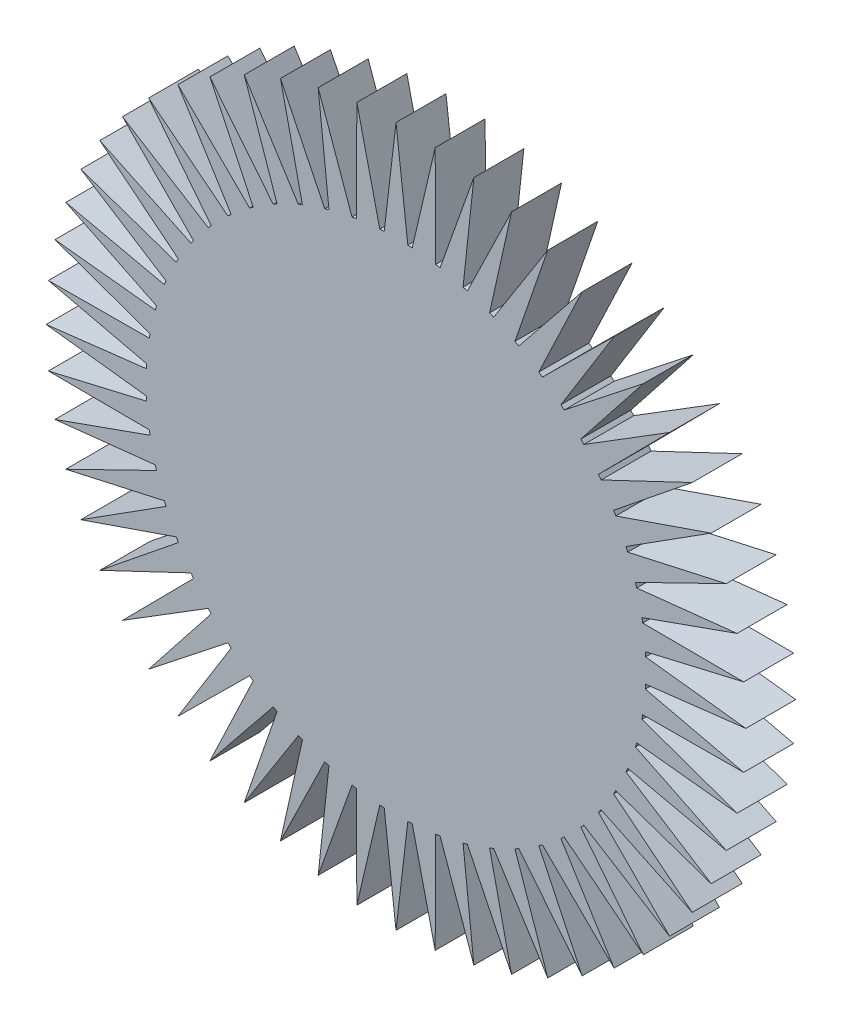
from build123d import *

# Parameters (mm, degrees)
ESQUISSE1_R             = 35
BOSS_EXTRU_1_DEPTH      = 5
ENL_V_START             = -5
ENL_V_MAT_EXTRU_2_DEPTH = 5


with BuildPart() as part:
    # Esquisse1 → Boss.-Extru.1 (new body)
    with BuildSketch(Plane.XY):
        Circle(ESQUISSE1_R)
    extrude(amount=BOSS_EXTRU_1_DEPTH)

    # Esquisse3 → Enlèv. mat.-Extru.2 (cut)
    with BuildSketch(Plane.XY.offset(5).offset(ENL_V_START)):
        with BuildLine():
            Line((-11.898891299, 21.986732041), (-15.185930869, 31.533910377))
            ThreePointArc((-15.185930869, 31.533910377), (-16.930161049, 30.632819767), (-18.621122678, 29.635346973))
            Line((-18.621122678, 29.635346973), (-12.286106235, 21.77272591))
            ThreePointArc((-12.286106235, 21.77272591), (-12.092972178, 21.880585548), (-11.898891299, 21.986732041))
        make_face()
        with BuildLine():
            Line((-9.362340634, 23.180737216), (-11.559767168, 33.035916561))
            ThreePointArc((-11.559767168, 33.035916561), (-13.393920133, 32.335783638), (-15.185930869, 31.533910377))
            Line((-15.185930869, 31.533910377), (-9.771081928, 23.011431028))
            ThreePointArc((-9.771081928, 23.011431028), (-9.567085809, 23.096988313), (-9.362340634, 23.180737216))
        make_face()
        with BuildLine():
            Line((-6.708053103, 24.08323117), (-7.788232688, 34.122476926))
            ThreePointArc((-7.788232688, 34.122476926), (-9.6892429, 33.632106268), (-11.559767168, 33.035916561))
            Line((-11.559767168, 33.035916561), (-7.133180597, 23.960754049))
            ThreePointArc((-7.133180597, 23.960754049), (-6.920887786, 24.022933049), (-6.708053103, 24.08323117))
        make_face()
        with BuildLine():
            Line((-3.969407912, 24.682864518), (-3.918756664, 34.779927346))
            ThreePointArc((-3.918756664, 34.779927346), (-5.862717816, 34.505485648), (-7.788232688, 34.122476926))
            Line((-7.788232688, 34.122476926), (-4.40557538, 24.608756685))
            ThreePointArc((-4.40557538, 24.608756685), (-4.187655583, 24.646775463), (-3.969407912, 24.682864518))
        make_face()
        with BuildLine():
            Line((-1.180845114, 24.972096524), (0, 35))
            ThreePointArc((0, 35), (-1.962465653, 34.944938526), (-3.918756664, 34.779927346))
            Line((-3.918756664, 34.779927346), (-1.622567497, 24.947289927))
            ThreePointArc((-1.622567497, 24.947289927), (-1.401761181, 24.960670375), (-1.180845114, 24.972096524))
        make_face()
        with BuildLine():
            ThreePointArc((3.918756664, 34.779927346), (1.962465653, 34.944938526), (0, 35))
            Line((0, 35), (1.180845114, 24.972096524))
            ThreePointArc((1.180845114, 24.972096524), (1.401761181, 24.960670375), (1.622567497, 24.947289927))
            Line((1.622567497, 24.947289927), (3.918756664, 34.779927346))
        make_face()
        with BuildLine():
            ThreePointArc((7.788232688, 34.122476926), (5.862717816, 34.505485648), (3.918756664, 34.779927346))
            Line((3.918756664, 34.779927346), (3.969407912, 24.682864518))
            ThreePointArc((3.969407912, 24.682864518), (4.187655583, 24.646775463), (4.40557538, 24.608756685))
            Line((4.40557538, 24.608756685), (7.788232688, 34.122476926))
        make_face()
        with BuildLine():
            ThreePointArc((11.559767168, 33.035916561), (9.6892429, 33.632106268), (7.788232688, 34.122476926))
            Line((7.788232688, 34.122476926), (6.708053103, 24.08323117))
            ThreePointArc((6.708053103, 24.08323117), (6.920887786, 24.022933049), (7.133180597, 23.960754049))
            Line((7.133180597, 23.960754049), (11.559767168, 33.035916561))
        make_face()
        with BuildLine():
            ThreePointArc((15.185930869, 31.533910377), (13.393920133, 32.335783638), (11.559767168, 33.035916561))
            Line((11.559767168, 33.035916561), (9.362340634, 23.180737216))
            ThreePointArc((9.362340634, 23.180737216), (9.567085809, 23.096988313), (9.771081928, 23.011431028))
            Line((9.771081928, 23.011431028), (15.185930869, 31.533910377))
        make_face()
        with BuildLine():
            ThreePointArc((18.621122678, 29.635346973), (16.930161049, 30.632819767), (15.185930869, 31.533910377))
            Line((15.185930869, 31.533910377), (11.898891299, 21.986732041))
            ThreePointArc((11.898891299, 21.986732041), (12.092972178, 21.880585548), (12.286106235, 21.77272591))
            Line((12.286106235, 21.77272591), (18.621122678, 29.635346973))
        make_face()
        with BuildLine():
            ThreePointArc((21.822143065, 27.364101886), (20.253495366, 28.544630414), (18.621122678, 29.635346973))
            Line((18.621122678, 29.635346973), (14.285806502, 20.516230955))
            ThreePointArc((14.285806502, 20.516230955), (14.466782404, 20.389021724), (14.646625628, 20.260216132))
            Line((14.646625628, 20.260216132), (21.822143065, 27.364101886))
        make_face()
        with BuildLine():
            ThreePointArc((24.748737342, 24.748737342), (23.322130228, 26.097475771), (21.822143065, 27.364101886))
            Line((21.822143065, 27.364101886), (16.4930694, 18.78772636))
            ThreePointArc((16.4930694, 18.78772636), (16.658664449, 18.641054122), (16.822955205, 18.49292238))
            Line((16.822955205, 18.49292238), (24.748737342, 24.748737342))
        make_face()
        with BuildLine():
            Line((-14.285806502, 20.516230955), (-18.621122678, 29.635346973))
            ThreePointArc((-18.621122678, 29.635346973), (-20.253495366, 28.544630414), (-21.822143065, 27.364101886))
            Line((-21.822143065, 27.364101886), (-14.646625628, 20.260216132))
            ThreePointArc((-14.646625628, 20.260216132), (-14.466782404, 20.389021724), (-14.285806502, 20.516230955))
        make_face()
        with BuildLine():
            Line((-16.4930694, 18.78772636), (-21.822143065, 27.364101886))
            ThreePointArc((-21.822143065, 27.364101886), (-23.322130228, 26.097475771), (-24.748737342, 24.748737342))
            Line((-24.748737342, 24.748737342), (-16.822955205, 18.49292238))
            ThreePointArc((-16.822955205, 18.49292238), (-16.658664449, 18.641054122), (-16.4930694, 18.78772636))
        make_face()
        with BuildLine():
            Line((-18.49292238, 16.822955205), (-24.748737342, 24.748737342))
            ThreePointArc((-24.748737342, 24.748737342), (-26.097475771, 23.322130228), (-27.364101886, 21.822143065))
            Line((-27.364101886, 21.822143065), (-18.78772636, 16.4930694))
            ThreePointArc((-18.78772636, 16.4930694), (-18.641054122, 16.658664449), (-18.49292238, 16.822955205))
        make_face()
        with BuildLine():
            Line((-20.260216132, 14.646625628), (-27.364101886, 21.822143065))
            ThreePointArc((-27.364101886, 21.822143065), (-28.544630414, 20.253495366), (-29.635346973, 18.621122678))
            Line((-29.635346973, 18.621122678), (-20.516230955, 14.285806502))
            ThreePointArc((-20.516230955, 14.285806502), (-20.389021724, 14.466782404), (-20.260216132, 14.646625628))
        make_face()
        with BuildLine():
            Line((-21.77272591, 12.286106235), (-29.635346973, 18.621122678))
            ThreePointArc((-29.635346973, 18.621122678), (-30.632819767, 16.930161049), (-31.533910377, 15.185930869))
            Line((-31.533910377, 15.185930869), (-21.986732041, 11.898891299))
            ThreePointArc((-21.986732041, 11.898891299), (-21.880585548, 12.092972178), (-21.77272591, 12.286106235))
        make_face()
        with BuildLine():
            Line((-23.011431028, 9.771081928), (-31.533910377, 15.185930869))
            ThreePointArc((-31.533910377, 15.185930869), (-32.335783638, 13.393920133), (-33.035916561, 11.559767168))
            Line((-33.035916561, 11.559767168), (-23.180737216, 9.362340634))
            ThreePointArc((-23.180737216, 9.362340634), (-23.096988313, 9.567085809), (-23.011431028, 9.771081928))
        make_face()
        with BuildLine():
            Line((-23.960754049, 7.133180597), (-33.035916561, 11.559767168))
            ThreePointArc((-33.035916561, 11.559767168), (-33.632106268, 9.6892429), (-34.122476926, 7.788232688))
            Line((-34.122476926, 7.788232688), (-24.08323117, 6.708053103))
            ThreePointArc((-24.08323117, 6.708053103), (-24.022933049, 6.920887786), (-23.960754049, 7.133180597))
        make_face()
        with BuildLine():
            Line((-24.608756685, 4.40557538), (-34.122476926, 7.788232688))
            ThreePointArc((-34.122476926, 7.788232688), (-34.505485648, 5.862717816), (-34.779927346, 3.918756664))
            Line((-34.779927346, 3.918756664), (-24.682864518, 3.969407912))
            ThreePointArc((-24.682864518, 3.969407912), (-24.646775463, 4.187655583), (-24.608756685, 4.40557538))
        make_face()
        with BuildLine():
            Line((-24.947289927, 1.622567497), (-34.779927346, 3.918756664))
            ThreePointArc((-34.779927346, 3.918756664), (-34.944938526, 1.962465653), (-35, 0))
            Line((-35, 0), (-24.972096524, 1.180845114))
            ThreePointArc((-24.972096524, 1.180845114), (-24.960670375, 1.401761181), (-24.947289927, 1.622567497))
        make_face()
        with BuildLine():
            Line((-24.972096524, -1.180845114), (-35, 0))
            ThreePointArc((-35, 0), (-34.944938526, -1.962465653), (-34.779927346, -3.918756664))
            Line((-34.779927346, -3.918756664), (-24.947289927, -1.622567497))
            ThreePointArc((-24.947289927, -1.622567497), (-24.960670375, -1.401761181), (-24.972096524, -1.180845114))
        make_face()
        with BuildLine():
            Line((-24.682864518, -3.969407912), (-34.779927346, -3.918756664))
            ThreePointArc((-34.779927346, -3.918756664), (-34.505485648, -5.862717816), (-34.122476926, -7.788232688))
            Line((-34.122476926, -7.788232688), (-24.608756685, -4.40557538))
            ThreePointArc((-24.608756685, -4.40557538), (-24.646775463, -4.187655583), (-24.682864518, -3.969407912))
        make_face()
        with BuildLine():
            Line((-24.08323117, -6.708053103), (-34.122476926, -7.788232688))
            ThreePointArc((-34.122476926, -7.788232688), (-33.632106268, -9.6892429), (-33.035916561, -11.559767168))
            Line((-33.035916561, -11.559767168), (-23.960754049, -7.133180597))
            ThreePointArc((-23.960754049, -7.133180597), (-24.022933049, -6.920887786), (-24.08323117, -6.708053103))
        make_face()
        with BuildLine():
            Line((-23.180737216, -9.362340634), (-33.035916561, -11.559767168))
            ThreePointArc((-33.035916561, -11.559767168), (-32.335783638, -13.393920133), (-31.533910377, -15.185930869))
            Line((-31.533910377, -15.185930869), (-23.011431028, -9.771081928))
            ThreePointArc((-23.011431028, -9.771081928), (-23.096988313, -9.567085809), (-23.180737216, -9.362340634))
        make_face()
        with BuildLine():
            Line((-21.986732041, -11.898891299), (-31.533910377, -15.185930869))
            ThreePointArc((-31.533910377, -15.185930869), (-30.632819767, -16.930161049), (-29.635346973, -18.621122678))
            Line((-29.635346973, -18.621122678), (-21.77272591, -12.286106235))
            ThreePointArc((-21.77272591, -12.286106235), (-21.880585548, -12.092972178), (-21.986732041, -11.898891299))
        make_face()
        with BuildLine():
            Line((-20.516230955, -14.285806502), (-29.635346973, -18.621122678))
            ThreePointArc((-29.635346973, -18.621122678), (-28.544630414, -20.253495366), (-27.364101886, -21.822143065))
            Line((-27.364101886, -21.822143065), (-20.260216132, -14.646625628))
            ThreePointArc((-20.260216132, -14.646625628), (-20.389021724, -14.466782404), (-20.516230955, -14.285806502))
        make_face()
        with BuildLine():
            Line((-18.78772636, -16.4930694), (-27.364101886, -21.822143065))
            ThreePointArc((-27.364101886, -21.822143065), (-26.097475771, -23.322130228), (-24.748737342, -24.748737342))
            Line((-24.748737342, -24.748737342), (-18.49292238, -16.822955205))
            ThreePointArc((-18.49292238, -16.822955205), (-18.641054122, -16.658664449), (-18.78772636, -16.4930694))
        make_face()
        with BuildLine():
            Line((-16.822955205, -18.49292238), (-24.748737342, -24.748737342))
            ThreePointArc((-24.748737342, -24.748737342), (-23.322130228, -26.097475771), (-21.822143065, -27.364101886))
            Line((-21.822143065, -27.364101886), (-16.4930694, -18.78772636))
            ThreePointArc((-16.4930694, -18.78772636), (-16.658664449, -18.641054122), (-16.822955205, -18.49292238))
        make_face()
        with BuildLine():
            Line((-14.646625628, -20.260216132), (-21.822143065, -27.364101886))
            ThreePointArc((-21.822143065, -27.364101886), (-20.253495366, -28.544630414), (-18.621122678, -29.635346973))
            Line((-18.621122678, -29.635346973), (-14.285806502, -20.516230955))
            ThreePointArc((-14.285806502, -20.516230955), (-14.466782404, -20.389021724), (-14.646625628, -20.260216132))
        make_face()
        with BuildLine():
            Line((-12.286106235, -21.77272591), (-18.621122678, -29.635346973))
            ThreePointArc((-18.621122678, -29.635346973), (-16.930161049, -30.632819767), (-15.185930869, -31.533910377))
            Line((-15.185930869, -31.533910377), (-11.898891299, -21.986732041))
            ThreePointArc((-11.898891299, -21.986732041), (-12.092972178, -21.880585548), (-12.286106235, -21.77272591))
        make_face()
        with BuildLine():
            Line((-9.771081928, -23.011431028), (-15.185930869, -31.533910377))
            ThreePointArc((-15.185930869, -31.533910377), (-13.393920133, -32.335783638), (-11.559767168, -33.035916561))
            Line((-11.559767168, -33.035916561), (-9.362340634, -23.180737216))
            ThreePointArc((-9.362340634, -23.180737216), (-9.567085809, -23.096988313), (-9.771081928, -23.011431028))
        make_face()
        with BuildLine():
            Line((-7.133180597, -23.960754049), (-11.559767168, -33.035916561))
            ThreePointArc((-11.559767168, -33.035916561), (-9.6892429, -33.632106268), (-7.788232688, -34.122476926))
            Line((-7.788232688, -34.122476926), (-6.708053103, -24.08323117))
            ThreePointArc((-6.708053103, -24.08323117), (-6.920887786, -24.022933049), (-7.133180597, -23.960754049))
        make_face()
        with BuildLine():
            Line((-4.40557538, -24.608756685), (-7.788232688, -34.122476926))
            ThreePointArc((-7.788232688, -34.122476926), (-5.862717816, -34.505485648), (-3.918756664, -34.779927346))
            Line((-3.918756664, -34.779927346), (-3.969407912, -24.682864518))
            ThreePointArc((-3.969407912, -24.682864518), (-4.187655583, -24.646775463), (-4.40557538, -24.608756685))
        make_face()
        with BuildLine():
            Line((-1.622567497, -24.947289927), (-3.918756664, -34.779927346))
            ThreePointArc((-3.918756664, -34.779927346), (-1.962465653, -34.944938526), (0, -35))
            Line((0, -35), (-1.180845114, -24.972096524))
            ThreePointArc((-1.180845114, -24.972096524), (-1.401761181, -24.960670375), (-1.622567497, -24.947289927))
        make_face()
        with BuildLine():
            ThreePointArc((0, -35), (1.962465653, -34.944938526), (3.918756664, -34.779927346))
            Line((3.918756664, -34.779927346), (1.622567497, -24.947289927))
            ThreePointArc((1.622567497, -24.947289927), (1.401761181, -24.960670375), (1.180845114, -24.972096524))
            Line((1.180845114, -24.972096524), (0, -35))
        make_face()
        with BuildLine():
            ThreePointArc((3.918756664, -34.779927346), (5.862717816, -34.505485648), (7.788232688, -34.122476926))
            Line((7.788232688, -34.122476926), (4.40557538, -24.608756685))
            ThreePointArc((4.40557538, -24.608756685), (4.187655583, -24.646775463), (3.969407912, -24.682864518))
            Line((3.969407912, -24.682864518), (3.918756664, -34.779927346))
        make_face()
        with BuildLine():
            ThreePointArc((7.788232688, -34.122476926), (9.6892429, -33.632106268), (11.559767168, -33.035916561))
            Line((11.559767168, -33.035916561), (7.133180597, -23.960754049))
            ThreePointArc((7.133180597, -23.960754049), (6.920887786, -24.022933049), (6.708053103, -24.08323117))
            Line((6.708053103, -24.08323117), (7.788232688, -34.122476926))
        make_face()
        with BuildLine():
            ThreePointArc((11.559767168, -33.035916561), (13.393920133, -32.335783638), (15.185930869, -31.533910377))
            Line((15.185930869, -31.533910377), (9.771081928, -23.011431028))
            ThreePointArc((9.771081928, -23.011431028), (9.567085809, -23.096988313), (9.362340634, -23.180737216))
            Line((9.362340634, -23.180737216), (11.559767168, -33.035916561))
        make_face()
        with BuildLine():
            ThreePointArc((15.185930869, -31.533910377), (16.930161049, -30.632819767), (18.621122678, -29.635346973))
            Line((18.621122678, -29.635346973), (12.286106235, -21.77272591))
            ThreePointArc((12.286106235, -21.77272591), (12.092972178, -21.880585548), (11.898891299, -21.986732041))
            Line((11.898891299, -21.986732041), (15.185930869, -31.533910377))
        make_face()
        with BuildLine():
            ThreePointArc((18.621122678, -29.635346973), (20.253495366, -28.544630414), (21.822143065, -27.364101886))
            Line((21.822143065, -27.364101886), (14.646625628, -20.260216132))
            ThreePointArc((14.646625628, -20.260216132), (14.466782404, -20.389021724), (14.285806502, -20.516230955))
            Line((14.285806502, -20.516230955), (18.621122678, -29.635346973))
        make_face()
        with BuildLine():
            ThreePointArc((21.822143065, -27.364101886), (23.322130228, -26.097475771), (24.748737342, -24.748737342))
            Line((24.748737342, -24.748737342), (16.822955205, -18.49292238))
            ThreePointArc((16.822955205, -18.49292238), (16.658664449, -18.641054122), (16.4930694, -18.78772636))
            Line((16.4930694, -18.78772636), (21.822143065, -27.364101886))
        make_face()
        with BuildLine():
            ThreePointArc((24.748737342, -24.748737342), (26.097475771, -23.322130228), (27.364101886, -21.822143065))
            Line((27.364101886, -21.822143065), (18.78772636, -16.4930694))
            ThreePointArc((18.78772636, -16.4930694), (18.641054122, -16.658664449), (18.49292238, -16.822955205))
            Line((18.49292238, -16.822955205), (24.748737342, -24.748737342))
        make_face()
        with BuildLine():
            ThreePointArc((27.364101886, -21.822143065), (28.544630414, -20.253495366), (29.635346973, -18.621122678))
            Line((29.635346973, -18.621122678), (20.516230955, -14.285806502))
            ThreePointArc((20.516230955, -14.285806502), (20.389021724, -14.466782404), (20.260216132, -14.646625628))
            Line((20.260216132, -14.646625628), (27.364101886, -21.822143065))
        make_face()
        with BuildLine():
            ThreePointArc((29.635346973, -18.621122678), (30.632819767, -16.930161049), (31.533910377, -15.185930869))
            Line((31.533910377, -15.185930869), (21.986732041, -11.898891299))
            ThreePointArc((21.986732041, -11.898891299), (21.880585548, -12.092972178), (21.77272591, -12.286106235))
            Line((21.77272591, -12.286106235), (29.635346973, -18.621122678))
        make_face()
        with BuildLine():
            ThreePointArc((31.533910377, -15.185930869), (32.335783638, -13.393920133), (33.035916561, -11.559767168))
            Line((33.035916561, -11.559767168), (23.180737216, -9.362340634))
            ThreePointArc((23.180737216, -9.362340634), (23.096988313, -9.567085809), (23.011431028, -9.771081928))
            Line((23.011431028, -9.771081928), (31.533910377, -15.185930869))
        make_face()
        with BuildLine():
            ThreePointArc((33.035916561, -11.559767168), (33.632106268, -9.6892429), (34.122476926, -7.788232688))
            Line((34.122476926, -7.788232688), (24.08323117, -6.708053103))
            ThreePointArc((24.08323117, -6.708053103), (24.022933049, -6.920887786), (23.960754049, -7.133180597))
            Line((23.960754049, -7.133180597), (33.035916561, -11.559767168))
        make_face()
        with BuildLine():
            ThreePointArc((34.122476926, -7.788232688), (34.505485648, -5.862717816), (34.779927346, -3.918756664))
            Line((34.779927346, -3.918756664), (24.682864518, -3.969407912))
            ThreePointArc((24.682864518, -3.969407912), (24.646775463, -4.187655583), (24.608756685, -4.40557538))
            Line((24.608756685, -4.40557538), (34.122476926, -7.788232688))
        make_face()
        with BuildLine():
            ThreePointArc((27.364101886, 21.822143065), (26.097475771, 23.322130228), (24.748737342, 24.748737342))
            Line((24.748737342, 24.748737342), (18.49292238, 16.822955205))
            ThreePointArc((18.49292238, 16.822955205), (18.641054122, 16.658664449), (18.78772636, 16.4930694))
            Line((18.78772636, 16.4930694), (27.364101886, 21.822143065))
        make_face()
        with BuildLine():
            ThreePointArc((29.635346973, 18.621122678), (28.544630414, 20.253495366), (27.364101886, 21.822143065))
            Line((27.364101886, 21.822143065), (20.260216132, 14.646625628))
            ThreePointArc((20.260216132, 14.646625628), (20.389021724, 14.466782404), (20.516230955, 14.285806502))
            Line((20.516230955, 14.285806502), (29.635346973, 18.621122678))
        make_face()
        with BuildLine():
            ThreePointArc((31.533910377, 15.185930869), (30.632819767, 16.930161049), (29.635346973, 18.621122678))
            Line((29.635346973, 18.621122678), (21.77272591, 12.286106235))
            ThreePointArc((21.77272591, 12.286106235), (21.880585548, 12.092972178), (21.986732041, 11.898891299))
            Line((21.986732041, 11.898891299), (31.533910377, 15.185930869))
        make_face()
        with BuildLine():
            ThreePointArc((33.035916561, 11.559767168), (32.335783638, 13.393920133), (31.533910377, 15.185930869))
            Line((31.533910377, 15.185930869), (23.011431028, 9.771081928))
            ThreePointArc((23.011431028, 9.771081928), (23.096988313, 9.567085809), (23.180737216, 9.362340634))
            Line((23.180737216, 9.362340634), (33.035916561, 11.559767168))
        make_face()
        with BuildLine():
            ThreePointArc((34.122476926, 7.788232688), (33.632106268, 9.6892429), (33.035916561, 11.559767168))
            Line((33.035916561, 11.559767168), (23.960754049, 7.133180597))
            ThreePointArc((23.960754049, 7.133180597), (24.022933049, 6.920887786), (24.08323117, 6.708053103))
            Line((24.08323117, 6.708053103), (34.122476926, 7.788232688))
        make_face()
        with BuildLine():
            ThreePointArc((34.779927346, 3.918756664), (34.505485648, 5.862717816), (34.122476926, 7.788232688))
            Line((34.122476926, 7.788232688), (24.608756685, 4.40557538))
            ThreePointArc((24.608756685, 4.40557538), (24.646775463, 4.187655583), (24.682864518, 3.969407912))
            Line((24.682864518, 3.969407912), (34.779927346, 3.918756664))
        make_face()
        with BuildLine():
            ThreePointArc((35, 0), (34.944938526, 1.962465653), (34.779927346, 3.918756664))
            Line((34.779927346, 3.918756664), (24.947289927, 1.622567497))
            ThreePointArc((24.947289927, 1.622567497), (24.960670375, 1.401761181), (24.972096524, 1.180845114))
            Line((24.972096524, 1.180845114), (35, 0))
        make_face()
        with BuildLine():
            ThreePointArc((34.779927346, -3.918756664), (34.944938526, -1.962465653), (35, 0))
            Line((35, 0), (24.972096524, -1.180845114))
            ThreePointArc((24.972096524, -1.180845114), (24.960670375, -1.401761181), (24.947289927, -1.622567497))
            Line((24.947289927, -1.622567497), (34.779927346, -3.918756664))
        make_face()
    extrude(amount=ENL_V_MAT_EXTRU_2_DEPTH, mode=Mode.SUBTRACT)


solid = part.part
